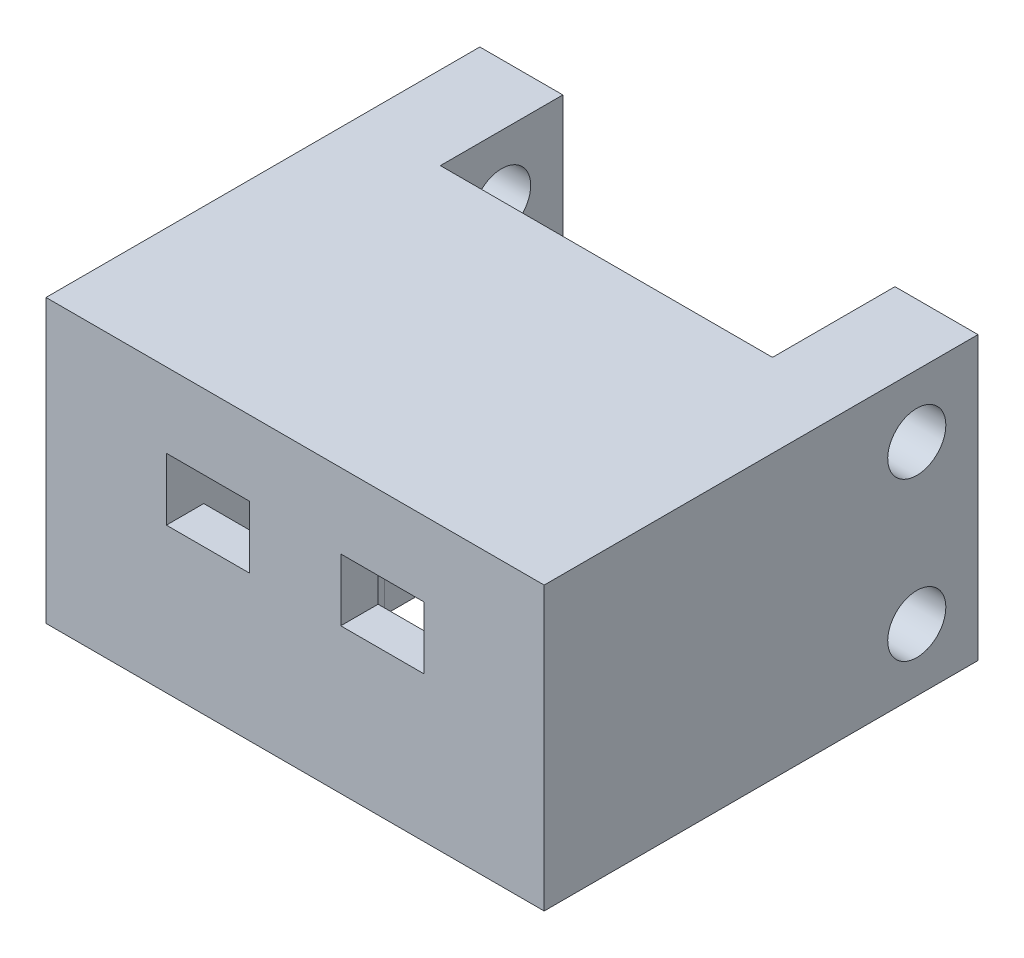
from build123d import *

# Parameters (mm, degrees)
EXTRUDE_1_DEPTH     = 1
EXTRUDE_2_DEPTH     = 4.8
SKETCH_4_W          = 2
SKETCH_4_H          = 5.8
EXTRUDE_3_DEPTH     = 10.45
SKETCH_5_W          = 2
SKETCH_5_H          = 2.95
EXTRUDE_4_DEPTH     = 1
SKETCH_6_W          = 2
SKETCH_6_H          = 1.5
CUT_EXTRUDE_1_DEPTH = 14.836274788
SKETCH_7_R          = 0.7
CUT_EXTRUDE_2_DEPTH = 16.122169157


with BuildPart() as part:
    # 草图1 → 凸台-拉伸1 (new body)
    with BuildSketch(Plane(origin=(0, 0, 0), x_dir=(1, 0, 0), z_dir=(0, 1, 0))):
        with BuildLine():
            Line((-4, 3.25), (-4, -4.25))
            Line((-4, -4.25), (4, -4.25))
            Line((4, -4.25), (4, 3.25))
            Line((4, 3.25), (2.1, 3.25))
            Line((2.1, 3.25), (2.1, 0))
            ThreePointArc((2.1, 0), (0, -2.1), (-2.1, 0))
            Line((-2.1, 0), (-2.1, 3.25))
            Line((-2.1, 3.25), (-4, 3.25))
        make_face()
    extrude(amount=EXTRUDE_1_DEPTH)

    # 草图3 → 凸台-拉伸2 (add)
    with BuildSketch(Plane(origin=(0, 1, 0), x_dir=(1, 0, 0), z_dir=(0, 1, 0))):
        Polygon((-3.1, 3.25), (-4, 3.25), (-4, -4.25), (4, -4.25), (4, 3.25), (3.1, 3.25), (3.1, -3.35), (-3.1, -3.35), align=None)
    extrude(amount=EXTRUDE_2_DEPTH)

    # 草图4 → 凸台-拉伸3 (add)
    with BuildSketch(Plane.XY.offset(4.25)):
        with Locations((5, 2.9)):
            Rectangle(SKETCH_4_W, SKETCH_4_H)
        with Locations((-5, 2.9)):
            Rectangle(SKETCH_4_W, SKETCH_4_H)
    extrude(amount=-EXTRUDE_3_DEPTH)

    # 草图5 → 凸台-拉伸4 (add)
    with BuildSketch(Plane(origin=(0, 5.8, 0), x_dir=(1, 0, 0), z_dir=(0, 1, 0))):
        Polygon((-6, 3.25), (-6, -4.25), (6, -4.25), (6, 3.25), (4, 3.25), (-4, 3.25), align=None)
        with Locations((-5, 4.725)):
            Rectangle(SKETCH_5_W, SKETCH_5_H)
        with Locations((5, 4.725)):
            Rectangle(SKETCH_5_W, SKETCH_5_H)
    extrude(amount=EXTRUDE_4_DEPTH)

    # 草图6 → 切除-拉伸1 (cut, through all)
    with BuildSketch(Plane.XY.offset(4.25)):
        with Locations((-2.1, 4.25)):
            Rectangle(SKETCH_6_W, SKETCH_6_H)
        with Locations((2.1, 4.25)):
            Rectangle(SKETCH_6_W, SKETCH_6_H)
    extrude(amount=-CUT_EXTRUDE_1_DEPTH, mode=Mode.SUBTRACT)

    # 草图7 → 切除-拉伸2 (cut, through all)
    with BuildSketch(Plane.ZY.offset(6)):
        with Locations(Location((-4.725, 5.3, 0), (0, 0, 270))):
            Circle(SKETCH_7_R)
        with Locations(Location((-4.725, 1.5, 0), (0, 0, 270))):
            Circle(SKETCH_7_R)
    extrude(amount=-CUT_EXTRUDE_2_DEPTH, mode=Mode.SUBTRACT)


solid = part.part
